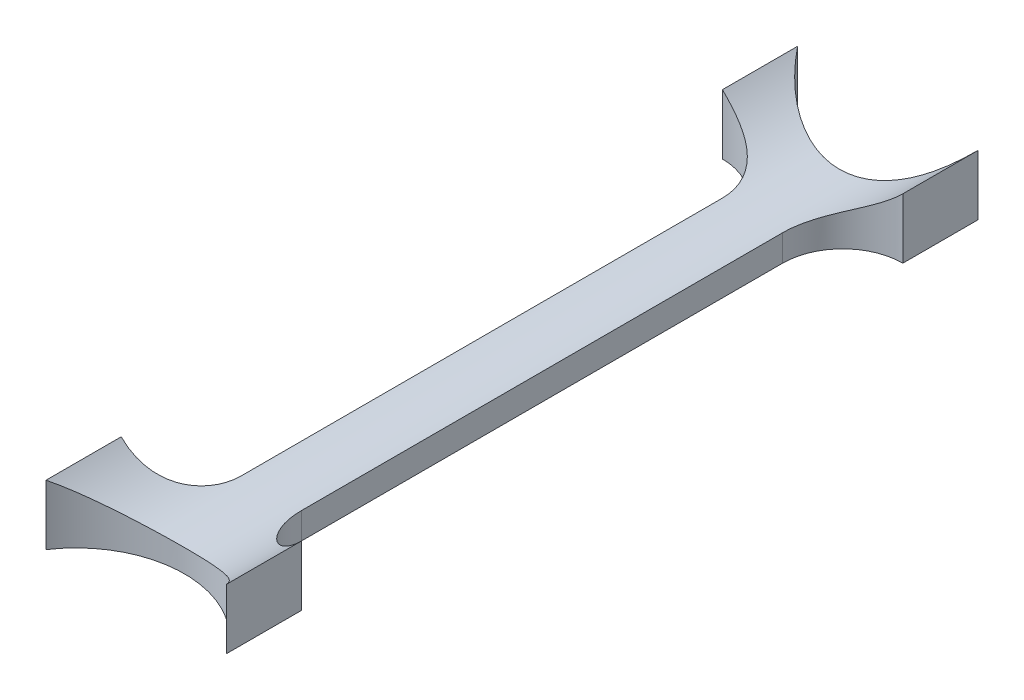
from build123d import *

# Parameters (mm, degrees)
BOSS_EXTRU_1_DEPTH           = 10
ENL_V_MAT_EXTRU_1_DEPTH      = 66.048059156
ENL_V_MAT_EXTRU_1_DEPTH_BACK = 66.048059156


with BuildPart() as part:
    # Esquisse1 → Boss.-Extru.1 (new body)
    with BuildSketch(Plane(origin=(0, 0, 0), x_dir=(1, 0, 0), z_dir=(0, 1, 0))):
        with BuildLine():
            Line((-15, 62.5), (-15, 50))
            ThreePointArc((-15, 50), (-7.928932188, 47.071067812), (-5, 40))
            Line((-5, 40), (-5, -40))
            ThreePointArc((-5, -40), (-7.928932188, -47.071067812), (-15, -50))
            Line((-15, -50), (-15, -62.5))
            ThreePointArc((-15, -62.5), (0, -54.472243623), (15, -62.5))
            Line((15, -62.5), (15, -50))
            ThreePointArc((15, -50), (7.928932188, -47.071067812), (5, -40))
            Line((5, -40), (5, 40))
            ThreePointArc((5, 40), (7.928932188, 47.071067812), (15, 50))
            Line((15, 50), (15, 62.5))
            ThreePointArc((15, 62.5), (0, 54.472243623), (-15, 62.5))
        make_face()
    extrude(amount=BOSS_EXTRU_1_DEPTH)

    # Esquisse2 → Enlèv. mat.-Extru.1 (cut, two sides: drawn at the far end of the back side and taken through both)
    with BuildSketch(Plane.XY.offset(-ENL_V_MAT_EXTRU_1_DEPTH_BACK)):
        with BuildLine():
            ThreePointArc((-15, 10), (-8.117941502, 5.401555527), (0, 3.786796564))
            Line((0, 3.786796564), (0, 10))
            Line((0, 10), (-15, 10))
        make_face()
        with BuildLine():
            Line((0, 10), (0, 3.786796564))
            ThreePointArc((0, 3.786796564), (8.117941502, 5.401555527), (15, 10))
            Line((15, 10), (0, 10))
        make_face()
        with BuildLine():
            ThreePointArc((-15, 10), (-8.117941502, 5.401555527), (0, 3.786796564))
            Line((0, 3.786796564), (0, 10))
            Line((0, 10), (-15, 10))
        make_face()
        with BuildLine():
            Line((0, 10), (0, 3.786796564))
            ThreePointArc((0, 3.786796564), (8.117941502, 5.401555527), (15, 10))
            Line((15, 10), (0, 10))
        make_face()
    extrude(amount=ENL_V_MAT_EXTRU_1_DEPTH + ENL_V_MAT_EXTRU_1_DEPTH_BACK, mode=Mode.SUBTRACT)


solid = part.part
